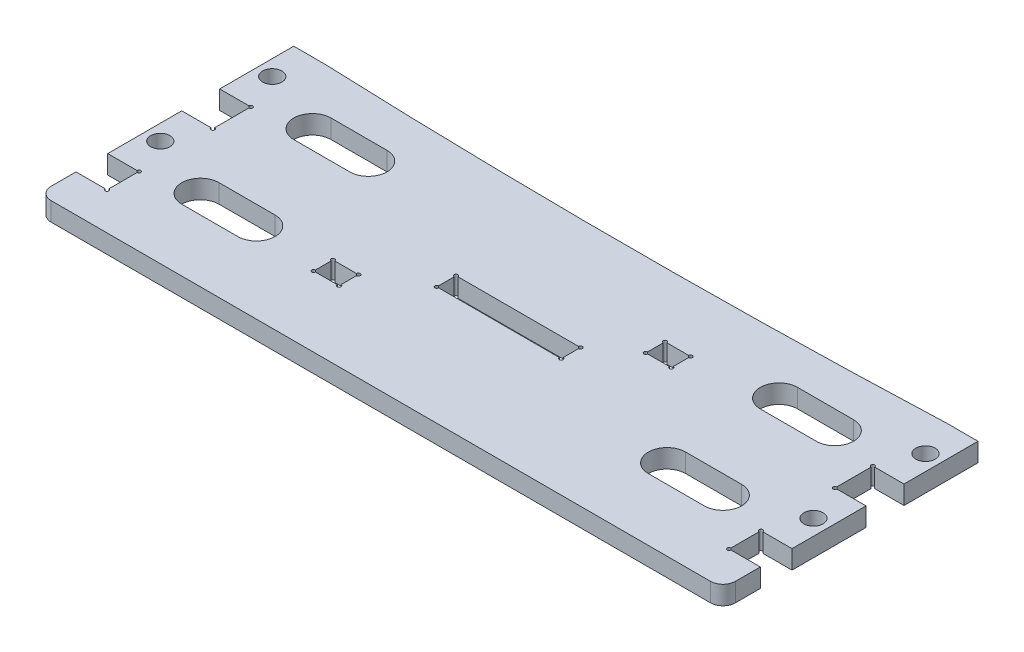
from build123d import *

# Parameters (mm, degrees)
BOSS_EXTRUDE1_DEPTH = 3
SKETCH2_W           = 4.1
SKETCH2_H           = 3.1
CUT_EXTRUDE1_DEPTH  = 10
BOSS_EXTRUDE2_DEPTH = 3
FILLET2_R           = 2
SKETCH5_W           = 20
SKETCH5_H           = 3.1
SKETCH5_R           = 1.55
CUT_EXTRUDE3_DEPTH  = 3
CUT_EXTRUDE2_DEPTH  = 10


with BuildPart() as part:
    # Sketch1 → Boss-Extrude1 (new body)
    with BuildSketch(Plane(origin=(0, 0, 0), x_dir=(1, 0, 0), z_dir=(0, 1, 0))):
        with BuildLine():
            Line((55, 34), (55, 22.1))
            Line((55, 22.1), (50, 22.1))
            Line((50, 22.1), (50, 16))
            Line((50, 16), (55, 16))
            Line((55, 16), (55, 4.1))
            Line((55, 4.1), (50, 4.1))
            Line((50, 4.1), (50, 0))
            Line((50, 0), (-50, 0))
            Line((-50, 0), (-50, 4.1))
            Line((-50, 4.1), (-55, 4.1))
            Line((-55, 4.1), (-55, 16))
            Line((-55, 16), (-50, 16))
            Line((-50, 16), (-50, 22.1))
            Line((-50, 22.1), (-55, 22.1))
            Line((-55, 22.1), (-55, 34))
            Line((-55, 34), (-50, 34))
            ThreePointArc((-50, 34), (0, 33), (50, 34))
            Line((50, 34), (55, 34))
        make_face()
        with BuildLine():
            Line((33, 9), (42, 9))
            ThreePointArc((42, 9), (45, 6), (42, 3))
            Line((42, 3), (33, 3))
            ThreePointArc((33, 3), (30, 6), (33, 9))
        make_face(mode=Mode.SUBTRACT)
        with BuildLine():
            Line((-33, 21), (-42, 21))
            ThreePointArc((-42, 21), (-45, 24), (-42, 27))
            Line((-42, 27), (-33, 27))
            ThreePointArc((-33, 27), (-30, 24), (-33, 21))
        make_face(mode=Mode.SUBTRACT)
        with BuildLine():
            Line((42, 27), (33, 27))
            ThreePointArc((33, 27), (30, 24), (33, 21))
            Line((33, 21), (42, 21))
            ThreePointArc((42, 21), (45, 24), (42, 27))
        make_face(mode=Mode.SUBTRACT)
        with BuildLine():
            Line((-42, 3), (-33, 3))
            ThreePointArc((-33, 3), (-30, 6), (-33, 9))
            Line((-33, 9), (-42, 9))
            ThreePointArc((-42, 9), (-45, 6), (-42, 3))
        make_face(mode=Mode.SUBTRACT)
    extrude(amount=BOSS_EXTRUDE1_DEPTH)

    # Sketch2 → Cut-Extrude1 (cut)
    with BuildSketch(Plane(origin=(0, 3, 0), x_dir=(1, 0, 0), z_dir=(0, 1, 0))):
        with Locations((-20.05, 5.85)):
            Rectangle(SKETCH2_W, SKETCH2_H)
        with Locations((18.05, 21.15)):
            Rectangle(SKETCH2_W, SKETCH2_H)
    extrude(amount=-CUT_EXTRUDE1_DEPTH, mode=Mode.SUBTRACT)

    # Sketch3 → Boss-Extrude2 (add)
    with BuildSketch(Plane(origin=(0, 3, 0), x_dir=(1, 0, 0), z_dir=(0, 1, 0))):
        Polygon((-50, 0), (-50, -1), (-55, -1), (-55, -7), (55, -7), (55, -1), (50, -1), (50, 0), align=None)
    extrude(amount=-BOSS_EXTRUDE2_DEPTH)

    # Fillet2
    fillet2_edges = [part.edges().sort_by_distance(p)[0] for p in [
        (55, 1.5, 7),
        (-55, 1.5, 7),
    ]]
    fillet(fillet2_edges, radius=FILLET2_R)

    # Sketch5 → Cut-Extrude3 (cut)
    with BuildSketch(Plane(origin=(0, 3, 0), x_dir=(1, 0, 0), z_dir=(0, 1, 0))):
        with Locations((0, 13.55)):
            Rectangle(SKETCH5_W, SKETCH5_H)
        with Locations((52.5, 28.05)):
            Circle(SKETCH5_R)
        with Locations((52.5, 10.05)):
            Circle(SKETCH5_R)
        with Locations((-52.5, 10.05)):
            Circle(SKETCH5_R)
        with Locations((-52.5, 28.05)):
            Circle(SKETCH5_R)
    extrude(amount=-CUT_EXTRUDE3_DEPTH, mode=Mode.SUBTRACT)

    # Sketch4 → Cut-Extrude2 (cut)
    with BuildSketch(Plane(origin=(0, 3, 0), x_dir=(1, 0, 0), z_dir=(0, 1, 0))):
        with BuildLine():
            ThreePointArc((-50, 3.8), (-49.787867966, 4.312132034), (-50.3, 4.1))
            Line((-50.3, 4.1), (-50, 4.1))
            Line((-50, 4.1), (-50, 3.8))
        make_face()
        with BuildLine():
            Line((-50, -0.7), (-50, -1))
            Line((-50, -1), (-50.3, -1))
            ThreePointArc((-50.3, -1), (-49.787867966, -1.212132034), (-50, -0.7))
        make_face()
        with BuildLine():
            ThreePointArc((-50, 21.8), (-49.787867966, 22.312132034), (-50.3, 22.1))
            Line((-50.3, 22.1), (-50, 22.1))
            Line((-50, 22.1), (-50, 21.8))
        make_face()
        with BuildLine():
            ThreePointArc((-50.3, 16), (-49.787867966, 15.787867966), (-50, 16.3))
            Line((-50, 16.3), (-50, 16))
            Line((-50, 16), (-50.3, 16))
        make_face()
        with BuildLine():
            Line((50.3, 16), (50, 16))
            Line((50, 16), (50, 16.3))
            ThreePointArc((50, 16.3), (49.787867966, 15.787867966), (50.3, 16))
        make_face()
        with BuildLine():
            Line((50, 21.8), (50, 22.1))
            Line((50, 22.1), (50.3, 22.1))
            ThreePointArc((50.3, 22.1), (49.787867966, 22.312132034), (50, 21.8))
        make_face()
        with BuildLine():
            Line((50.3, -1), (50, -1))
            Line((50, -1), (50, -0.7))
            ThreePointArc((50, -0.7), (49.787867966, -1.212132034), (50.3, -1))
        make_face()
        with BuildLine():
            Line((50, 3.8), (50, 4.1))
            Line((50, 4.1), (50.3, 4.1))
            ThreePointArc((50.3, 4.1), (49.787867966, 4.312132034), (50, 3.8))
        make_face()
        with BuildLine():
            ThreePointArc((-21.8, 7.4), (-22.312132034, 7.612132034), (-22.1, 7.1))
            Line((-22.1, 7.1), (-22.1, 7.4))
            Line((-22.1, 7.4), (-21.8, 7.4))
        make_face()
        with BuildLine():
            ThreePointArc((-18, 7.1), (-17.787867966, 7.612132034), (-18.3, 7.4))
            Line((-18.3, 7.4), (-18, 7.4))
            Line((-18, 7.4), (-18, 7.1))
        make_face()
        with BuildLine():
            ThreePointArc((-18.3, 4.3), (-17.787867966, 4.087867966), (-18, 4.6))
            Line((-18, 4.6), (-18, 4.3))
            Line((-18, 4.3), (-18.3, 4.3))
        make_face()
        with BuildLine():
            ThreePointArc((-22.1, 4.6), (-22.312132034, 4.087867966), (-21.8, 4.3))
            Line((-21.8, 4.3), (-22.1, 4.3))
            Line((-22.1, 4.3), (-22.1, 4.6))
        make_face()
        with BuildLine():
            ThreePointArc((16.3, 22.7), (15.787867966, 22.912132034), (16, 22.4))
            Line((16, 22.4), (16, 22.7))
            Line((16, 22.7), (16.3, 22.7))
        make_face()
        with BuildLine():
            ThreePointArc((20.1, 22.4), (20.312132034, 22.912132034), (19.8, 22.7))
            Line((19.8, 22.7), (20.1, 22.7))
            Line((20.1, 22.7), (20.1, 22.4))
        make_face()
        with BuildLine():
            ThreePointArc((19.8, 19.6), (20.312132034, 19.387867966), (20.1, 19.9))
            Line((20.1, 19.9), (20.1, 19.6))
            Line((20.1, 19.6), (19.8, 19.6))
        make_face()
        with BuildLine():
            ThreePointArc((16, 19.9), (15.787867966, 19.387867966), (16.3, 19.6))
            Line((16.3, 19.6), (16, 19.6))
            Line((16, 19.6), (16, 19.9))
        make_face()
        with BuildLine():
            ThreePointArc((-9.7, 15.1), (-10.212132034, 15.312132034), (-10, 14.8))
            Line((-10, 14.8), (-10, 15.1))
            Line((-10, 15.1), (-9.7, 15.1))
        make_face()
        with BuildLine():
            ThreePointArc((10, 14.8), (10.212132034, 15.312132034), (9.7, 15.1))
            Line((9.7, 15.1), (10, 15.1))
            Line((10, 15.1), (10, 14.8))
        make_face()
        with BuildLine():
            ThreePointArc((9.7, 12), (10.212132034, 11.787867966), (10, 12.3))
            Line((10, 12.3), (10, 12))
            Line((10, 12), (9.7, 12))
        make_face()
        with BuildLine():
            ThreePointArc((-10, 12.3), (-10.212132034, 11.787867966), (-9.7, 12))
            Line((-9.7, 12), (-10, 12))
            Line((-10, 12), (-10, 12.3))
        make_face()
    extrude(amount=-CUT_EXTRUDE2_DEPTH, mode=Mode.SUBTRACT)


solid = part.part
